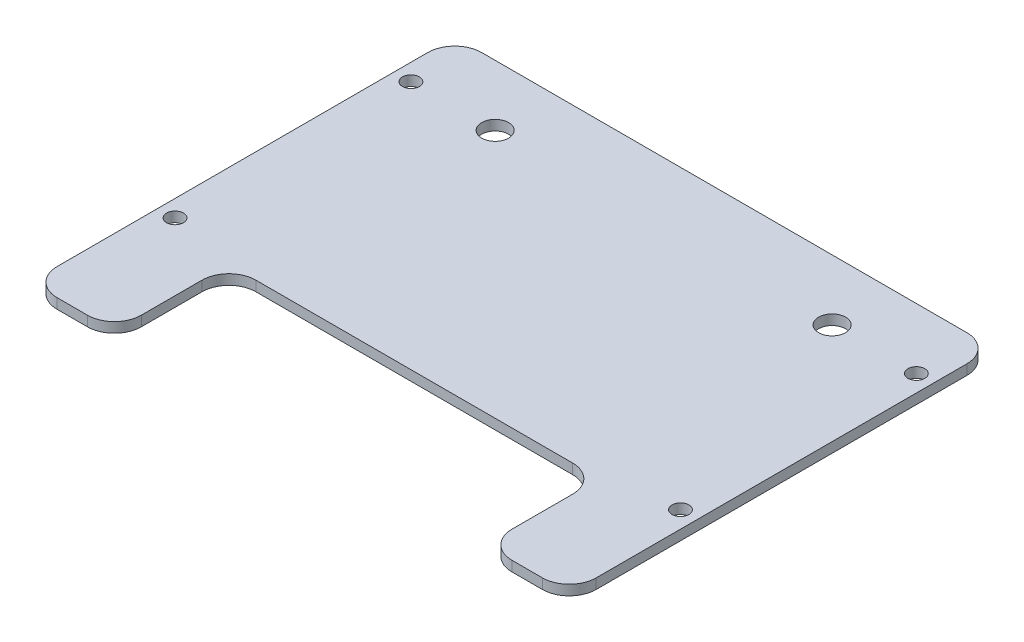
from build123d import *

# Parameters (mm, degrees)
ESQUISSE1_W             = 80
ESQUISSE1_H             = 63
BOSS_EXTRU_1_DEPTH      = 1.5
ESQUISSE2_R             = 1.25
ESQUISSE2_R_2           = 2
ESQUISSE2_W             = 55
ESQUISSE2_H             = 17
ENL_V_MAT_EXTRU_1_DEPTH = 75.640806534
CONG_1_R                = 4


with BuildPart() as part:
    # Esquisse1 → Boss.-Extru.1 (new body)
    with BuildSketch(Plane(origin=(0, 0, 0), x_dir=(1, 0, 0), z_dir=(0, 1, 0))):
        with Locations((0, -31.5)):
            Rectangle(ESQUISSE1_W, ESQUISSE1_H)
    extrude(amount=BOSS_EXTRU_1_DEPTH)

    # Esquisse2 → Enlèv. mat.-Extru.1 (cut, through all)
    with BuildSketch(Plane(origin=(0, 1.5, 0), x_dir=(1, 0, 0), z_dir=(0, 1, 0))):
        with Locations(Location((-37.5, -44, 0), (0, 0, 270))):
            Circle(ESQUISSE2_R)
        with Locations(Location((-37.5, -9, 0), (0, 0, 270))):
            Circle(ESQUISSE2_R)
        with Locations(Location((-25, -9, 0), (0, 0, 270))):
            Circle(ESQUISSE2_R_2)
        with Locations(Location((25, -9, 0), (0, 0, 90))):
            Circle(ESQUISSE2_R_2)
        with Locations(Location((37.5, -9, 0), (0, 0, 90))):
            Circle(ESQUISSE2_R)
        with Locations(Location((37.5, -44, 0), (0, 0, 90))):
            Circle(ESQUISSE2_R)
        with Locations((0, -54.5)):
            Rectangle(ESQUISSE2_W, ESQUISSE2_H)
    extrude(amount=-ENL_V_MAT_EXTRU_1_DEPTH, mode=Mode.SUBTRACT)

    # Congé1
    cong_1_edges = [part.edges().sort_by_distance(p)[0] for p in [
        (-27.5, 0.75, 63),
        (-27.5, 0.75, 46),
        (27.5, 0.75, 46),
        (27.5, 0.75, 63),
        (-40, 0.75, 0),
        (40, 0.75, 0),
        (40, 0.75, 63),
        (-40, 0.75, 63),
    ]]
    fillet(cong_1_edges, radius=CONG_1_R)


solid = part.part
